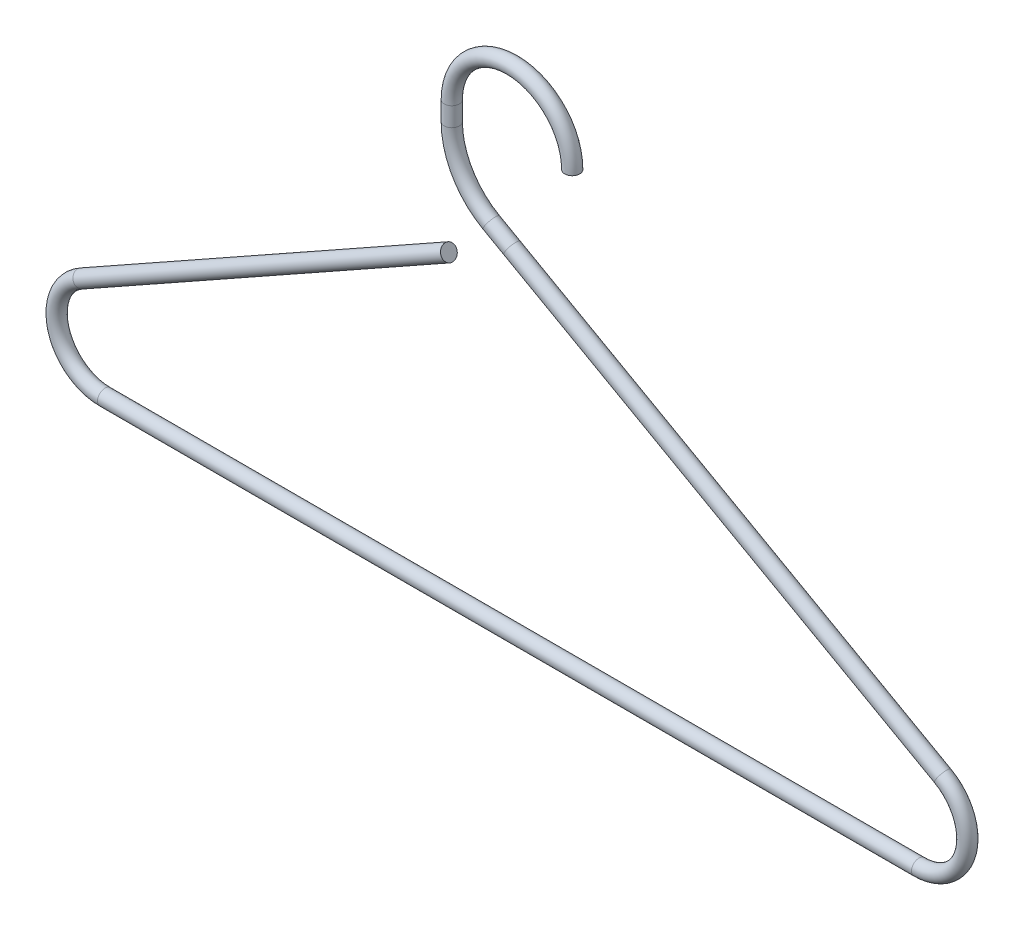
from build123d import *

# Parameters (mm, degrees)
SKETCH2_R = 2.5


with BuildPart() as part:
    # Sweep1: sweep along a path in Sketch1
    with BuildLine(Plane.XY) as sweep1_path:
        Line((-20.96310132, 50.720098642), (-143.073579672, -17.864169648))
        ThreePointArc((-143.073579672, -17.864169648), (-150.752246891, -35.945906478), (-135.202616283, -47.950910641))
        Line((-135.202616283, -47.950910641), (135.202616283, -47.950910641))
        ThreePointArc((135.202616283, -47.950910641), (150.752246891, -35.945906478), (143.073579672, -17.864169648))
        Line((143.073579672, -17.864169648), (0, 62.494182115))
        Line((0, 62.494182115), (-6.85216534, 66.342752298))
        ThreePointArc((-6.85216534, 66.342752298), (-16.471417859, 75.792531042), (-20, 88.807040077))
        Line((-20, 88.807040077), (-20, 95.128388362))
        ThreePointArc((-20, 95.128388362), (0.060396069, 115.12829717), (19.999635231, 95.007596775))
    # Sketch2 → Sweep1 (sweep)
    with BuildSketch(Plane(origin=(0, 0, 0), x_dir=(0, 0, -1), z_dir=(1, 0, 0))):
        with Locations((0, -47.950910641)):
            Circle(SKETCH2_R)
    sweep(path=sweep1_path.line)


solid = part.part
